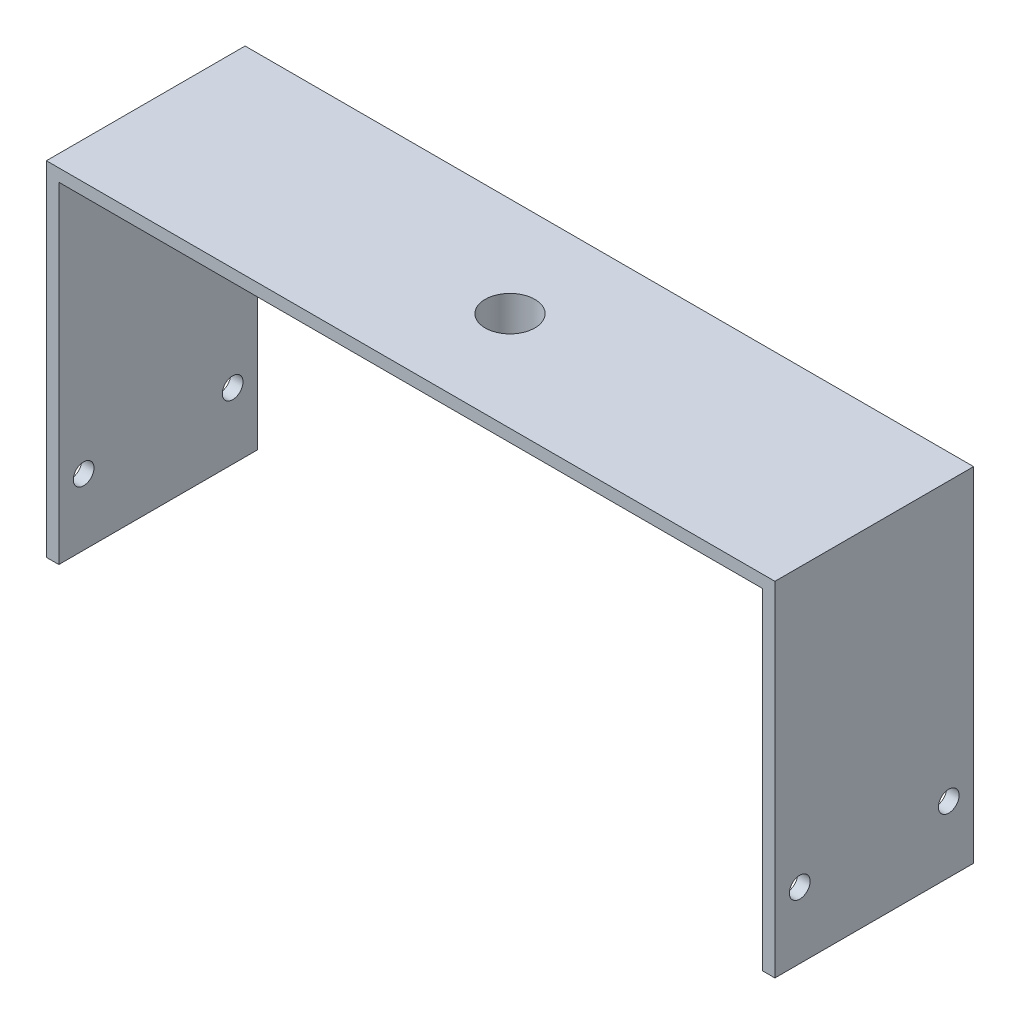
from build123d import *

# Parameters (mm, degrees)
BOSS_EXTRUDE1_DEPTH = 24
SKETCH2_R           = 1.25
CUT_EXTRUDE1_DEPTH  = 90
CUT_EXTRUDE2_REACH  = 83.273
SKETCH3_R           = 3
SKETCH4_R           = 3
BOSS_EXTRUDE2_DEPTH = 5


with BuildPart() as part:
    # Sketch1 → Boss-Extrude1 (new body)
    with BuildSketch(Plane.XY):
        Polygon((-22.371784864, -30.407843619), (-20.871784864, -30.407843619), (-20.871784864, 9.592156381), (64.128215136, 9.592156381), (64.128215136, -30.407843619), (65.628215136, -30.407843619), (65.628215136, 11.092156381), (-22.371784864, 11.092156381), align=None)
    extrude(amount=BOSS_EXTRUDE1_DEPTH)

    # Sketch2 → Cut-Extrude1 (cut)
    with BuildSketch(Plane.ZY.offset(22.371784864)):
        with Locations((3, -22.407843619)):
            Circle(SKETCH2_R)
        with Locations((21, -22.407843619)):
            Circle(SKETCH2_R)
    extrude(amount=-CUT_EXTRUDE1_DEPTH, mode=Mode.SUBTRACT)

    # Sketch3 → Cut-Extrude2 (cut, up to next)
    with BuildSketch(Plane(origin=(0, 11.092156381, 0), x_dir=(1, 0, 0), z_dir=(0, 1, 0)), mode=Mode.PRIVATE) as cut_extrude2_sk1:
        with Locations(Location((21.628215136, -12, 0), (0, 0, 180))):
            Circle(SKETCH3_R)
    cut_extrude2_tool1 = extrude(cut_extrude2_sk1.sketch, amount=-CUT_EXTRUDE2_REACH, mode=Mode.PRIVATE) & part.part
    add(cut_extrude2_tool1.solids().sort_by_distance((21.628215, 11.092156, 12))[0], mode=Mode.SUBTRACT)

    # Sketch4 → Boss-Extrude2 (add)
    with BuildSketch(Plane.XZ.offset(-9.592156381)):
        Polygon((18.628215136, 6.803847577), (24.628215136, 6.803847577), (27.628215136, 12), (24.628215136, 17.196152423), (18.628215136, 17.196152423), (15.628215136, 12), align=None)
        with Locations(Location((21.628215136, 12, 0), (0, 0, 180))):
            Circle(SKETCH4_R, mode=Mode.SUBTRACT)
    extrude(amount=BOSS_EXTRUDE2_DEPTH)


solid = part.part
